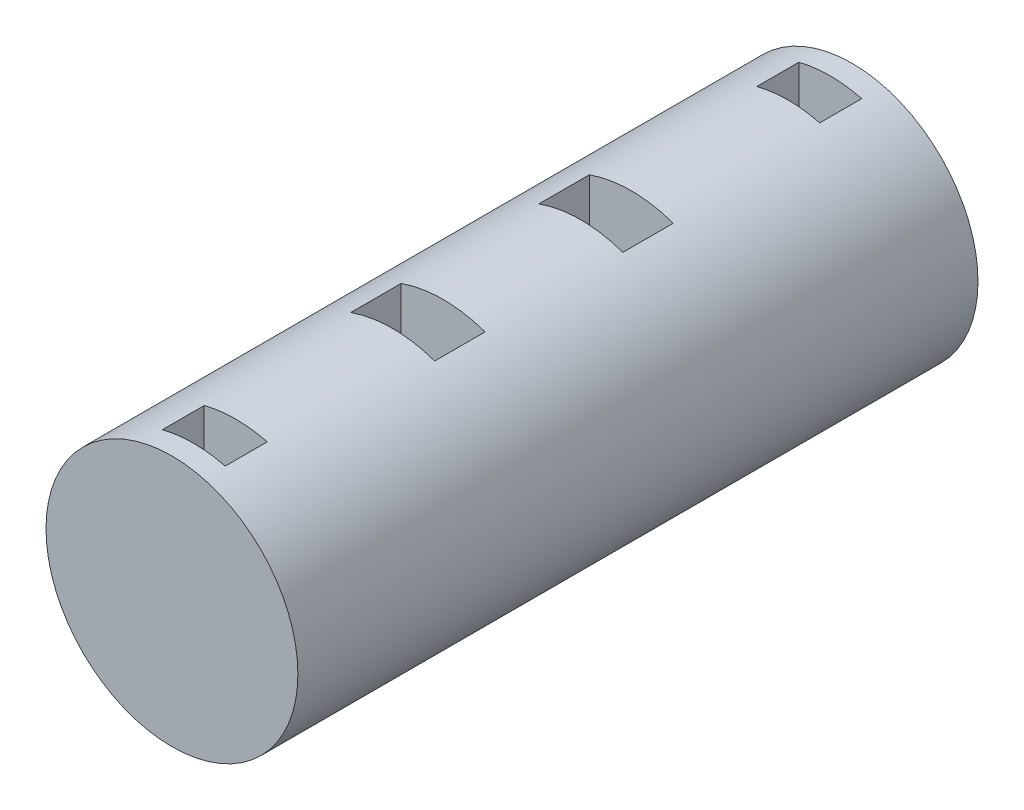
from build123d import *

# Parameters (mm, degrees)
SKETCH1_R           = 30
BOSS_EXTRUDE6_DEPTH = 81
SKETCH3_W           = 20
SKETCH3_H           = 12
CUT_EXTRUDE1_DEPTH  = 40.5
SKETCH4_W           = 15
SKETCH4_H           = 10
CUT_EXTRUDE2_DEPTH  = 40.5


with BuildPart() as part:
    # Sketch1 → Boss-Extrude6 (new body)
    with BuildSketch(Plane.XY):
        Circle(SKETCH1_R)
    extrude(amount=BOSS_EXTRUDE6_DEPTH)

    # Sketch3 → Cut-Extrude1 (cut, symmetric)
    with BuildSketch(Plane(origin=(0, 0, 0), x_dir=(1, 0, 0), z_dir=(0, 1, 0))):
        with Locations((0, -22.411705079)):
            Rectangle(SKETCH3_W, SKETCH3_H)
    extrude(amount=CUT_EXTRUDE1_DEPTH, both=True, mode=Mode.SUBTRACT)

    # Sketch4 → Cut-Extrude2 (cut, symmetric)
    with BuildSketch(Plane(origin=(0, 0, 0), x_dir=(1, 0, 0), z_dir=(0, 1, 0))):
        with Locations((0, -70.806519959)):
            Rectangle(SKETCH4_W, SKETCH4_H)
    extrude(amount=CUT_EXTRUDE2_DEPTH, both=True, mode=Mode.SUBTRACT)

    # Mirror1: part across plane


with BuildPart() as part_1:
    add(part.part)
    add(part.part.mirror(Plane.XY))


solid = part_1.part
